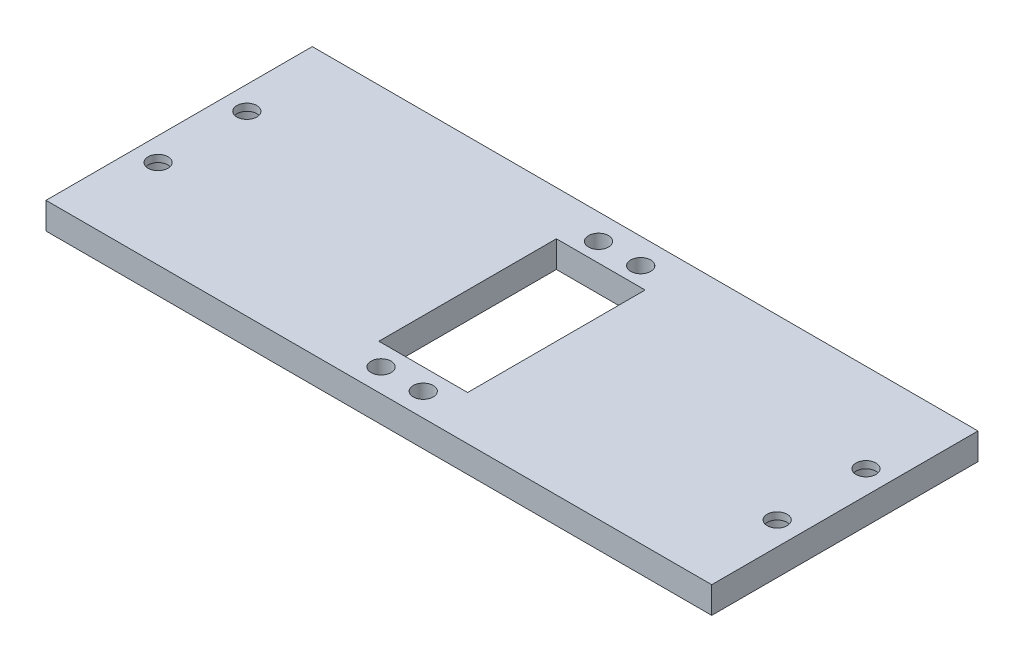
from build123d import *

# Parameters (mm, degrees)
SKETCH1_W                                           = 150
SKETCH1_H                                           = 60
SKETCH1_W_2                                         = 20
SKETCH1_H_2                                         = 40
BOSS_EXTRUDE1_DEPTH                                 = 6
CBORE_FOR_M4_HEX_SOCKET_HEAD_CAP_SCREW1_D           = 4.5
CBORE_FOR_M4_HEX_SOCKET_HEAD_CAP_SCREW1_CBORE_D     = 8
CBORE_FOR_M4_HEX_SOCKET_HEAD_CAP_SCREW1_CBORE_DEPTH = 4.4
M4_CLEARANCE_HOLE1_D                                = 4.5
M4_CLEARANCE_HOLE1_DEPTH                            = 8.499


with BuildPart() as part:
    # Sketch1 → Boss-Extrude1 (new body)
    with BuildSketch(Plane(origin=(0, 0, 0), x_dir=(1, 0, 0), z_dir=(0, 1, 0))):
        Rectangle(SKETCH1_W, SKETCH1_H)
        Rectangle(SKETCH1_W_2, SKETCH1_H_2, mode=Mode.SUBTRACT)
    extrude(amount=BOSS_EXTRUDE1_DEPTH)

    # CBORE for M4 Hex Socket Head Cap Screw1 (through all)
    with Locations(Plane(origin=(0, 0, 178.229982134), x_dir=(0, 0, 1), z_dir=(0, -1, 0))):
        with Locations((-168.229982134, -69.75), (-188.229982134, -69.75)):
            cbore_for_m4_hex_socket_head_cap_screw1 = CounterBoreHole(CBORE_FOR_M4_HEX_SOCKET_HEAD_CAP_SCREW1_D / 2, CBORE_FOR_M4_HEX_SOCKET_HEAD_CAP_SCREW1_CBORE_D / 2, CBORE_FOR_M4_HEX_SOCKET_HEAD_CAP_SCREW1_CBORE_DEPTH)

    # Mirror2: CBORE for M4 Hex Socket Head Cap Screw1 across plane
    add(cbore_for_m4_hex_socket_head_cap_screw1.mirror(Plane.ZY), mode=Mode.SUBTRACT)

    # M4 Clearance Hole1
    with Locations(Plane(origin=(0, 6, 178.229982134), x_dir=(0, 0, -1), z_dir=(0, 1, 0))):
        with Locations((153.479982134, 4.75), (153.479982134, -4.75), (202.479982134, -4.75), (202.479982134, 4.75)):
            Hole(M4_CLEARANCE_HOLE1_D / 2, depth=M4_CLEARANCE_HOLE1_DEPTH)


solid = part.part
